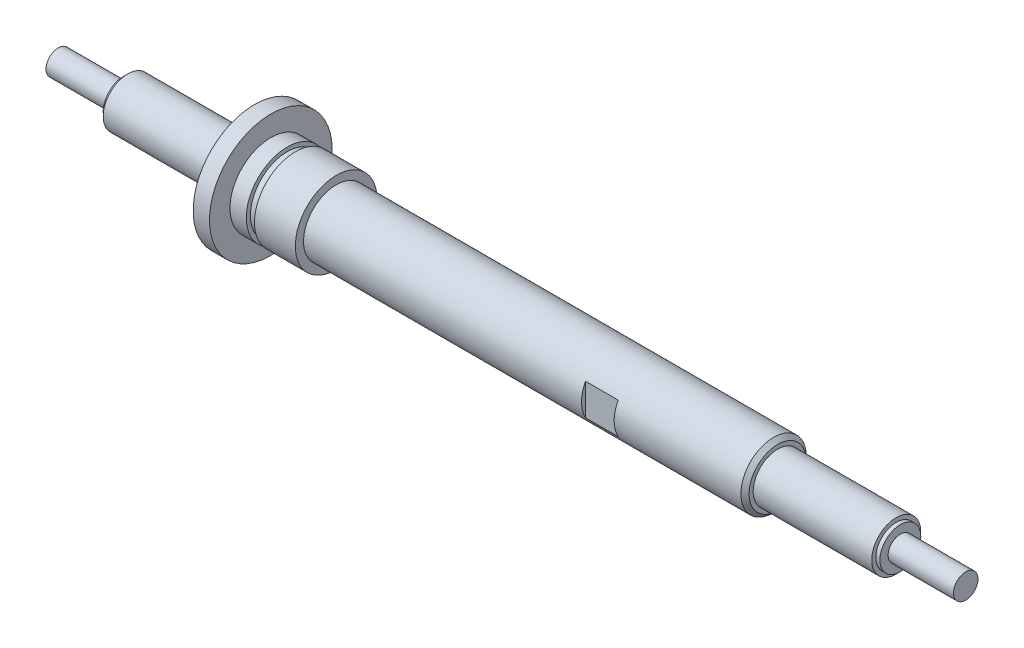
from build123d import *

# Parameters (mm, degrees)
SKETCH_1_R          = 4
EXTRUDE_1_DEPTH     = 1
SKETCH_2_R          = 3
EXTRUDE_2_DEPTH     = 6
SKETCH_3_R          = 3
EXTRUDE_3_DEPTH     = 17
SKETCH_4_R          = 7.5
EXTRUDE_4_DEPTH     = 2
SKETCH_5_R          = 5
EXTRUDE_5_DEPTH     = 8
SKETCH_6_R          = 4
EXTRUDE_6_DEPTH     = 54
EXTRUDE_START       = 6
SKETCH_7_R          = 3
EXTRUDE_7_DEPTH     = 6
EXTRUDE_START_2     = 17
SKETCH_8_R          = 3
EXTRUDE_8_DEPTH     = 17
CHAMFER_1_SIZE      = 0.5
CHAMFER_2_SIZE      = 0.5
CUT_EXTRUDE_START   = 2
SKETCH_11_R         = 5
SKETCH_11_R_2       = 4.5
CUT_EXTRUDE_2_DEPTH = 1
SKETCH_12_W         = 4
SKETCH_12_H         = 0.5
CUT_EXTRUDE_3_DEPTH = 5
SKETCH_14_R         = 3
SKETCH_14_R_2       = 1.5
CUT_EXTRUDE_5_DEPTH = 8
SKETCH_15_R         = 3
SKETCH_15_R_2       = 2.5
CUT_EXTRUDE_6_DEPTH = 0.5


with BuildPart() as part:
    # 草图1 → 凸台-拉伸1 (new body)
    with BuildSketch(Plane(origin=(0, 0, 0), x_dir=(0, 0, -1), z_dir=(1, 0, 0))):
        Circle(SKETCH_1_R)
    extrude(amount=EXTRUDE_1_DEPTH)

    # 草图2 → 凸台-拉伸2 (add)
    with BuildSketch(Plane.ZY):
        with Locations(Location((0, 0, 0), (0, 0, 180))):
            Circle(SKETCH_2_R)
    extrude(amount=EXTRUDE_2_DEPTH)

    # 草图3 → 凸台-拉伸3 (add)
    with BuildSketch(Plane.ZY.offset(6)):
        with Locations(Location((0, 0, 0), (0, 0, 180))):
            Circle(SKETCH_3_R)
    extrude(amount=EXTRUDE_3_DEPTH)

    # 草图4 → 凸台-拉伸4 (add)
    with BuildSketch(Plane(origin=(1, 0, 0), x_dir=(0, 0, -1), z_dir=(1, 0, 0))):
        Circle(SKETCH_4_R)
    extrude(amount=EXTRUDE_4_DEPTH)

    # 草图5 → 凸台-拉伸5 (add)
    with BuildSketch(Plane(origin=(3, 0, 0), x_dir=(0, 0, -1), z_dir=(1, 0, 0))):
        Circle(SKETCH_5_R)
    extrude(amount=EXTRUDE_5_DEPTH)

    # 草图6 → 凸台-拉伸6 (add)
    with BuildSketch(Plane(origin=(11, 0, 0), x_dir=(0, 0, -1), z_dir=(1, 0, 0))):
        Circle(SKETCH_6_R)
    extrude(amount=EXTRUDE_6_DEPTH)

    # 草图7 → 凸台-拉伸7 (add)
    with BuildSketch(Plane(origin=(65, 0, 0), x_dir=(0, 0, -1), z_dir=(1, 0, 0)).offset(EXTRUDE_START)):
        Circle(SKETCH_7_R)
    extrude(amount=-EXTRUDE_7_DEPTH)

    # 草图8 → 凸台-拉伸8 (add)
    with BuildSketch(Plane(origin=(71, 0, 0), x_dir=(0, 0, -1), z_dir=(1, 0, 0)).offset(EXTRUDE_START_2)):
        Circle(SKETCH_8_R)
    extrude(amount=-EXTRUDE_8_DEPTH)

    # 倒角1
    chamfer_1_edges = [part.edges().sort_by_distance(p)[0] for p in [
        (65, 0, 4),
    ]]
    chamfer(chamfer_1_edges, length=CHAMFER_1_SIZE)

    # 倒角2
    chamfer_2_edges = [part.edges().sort_by_distance(p)[0] for p in [
        (0, 0, 4),
    ]]
    chamfer(chamfer_2_edges, length=CHAMFER_2_SIZE)

    # 草图11 → 切除-拉伸2 (cut)
    with BuildSketch(Plane(origin=(3, 0, 0), x_dir=(0, 0, -1), z_dir=(1, 0, 0)).offset(CUT_EXTRUDE_START)):
        Circle(SKETCH_11_R)
        Circle(SKETCH_11_R_2, mode=Mode.SUBTRACT)
    extrude(amount=CUT_EXTRUDE_2_DEPTH, mode=Mode.SUBTRACT)

    # 草图12 → 切除-拉伸3 (cut, symmetric)
    with BuildSketch(Plane(origin=(0, 0, 0), x_dir=(1, 0, 0), z_dir=(0, 1, 0))):
        with Locations((47, 3.75)):
            Rectangle(SKETCH_12_W, SKETCH_12_H)
        with Locations((47, -3.75)):
            Rectangle(SKETCH_12_W, SKETCH_12_H)
    extrude(amount=CUT_EXTRUDE_3_DEPTH, both=True, mode=Mode.SUBTRACT)

    # 草图14 → 切除-拉伸5 (cut)
    with BuildSketch(Plane(origin=(88, 0, 0), x_dir=(0, 0, -1), z_dir=(1, 0, 0))):
        Circle(SKETCH_14_R)
        Circle(SKETCH_14_R_2, mode=Mode.SUBTRACT)
    cut_extrude_5 = extrude(amount=-CUT_EXTRUDE_5_DEPTH, mode=Mode.SUBTRACT)

    # 草图15 → 切除-拉伸6 (cut)
    with BuildSketch(Plane(origin=(80, 0, 0), x_dir=(0, 0, -1), z_dir=(1, 0, 0))):
        Circle(SKETCH_15_R)
        Circle(SKETCH_15_R_2, mode=Mode.SUBTRACT)
    cut_extrude_6 = extrude(amount=-CUT_EXTRUDE_6_DEPTH, mode=Mode.SUBTRACT)

    # 镜向2: 切除-拉伸5, 切除-拉伸6 across plane
    add(cut_extrude_5.mirror(Plane(origin=(32.5, 0, 0), x_dir=(0, 0, 1), z_dir=(1, 0, 0))), mode=Mode.SUBTRACT)
    add(cut_extrude_6.mirror(Plane(origin=(32.5, 0, 0), x_dir=(0, 0, 1), z_dir=(1, 0, 0))), mode=Mode.SUBTRACT)


solid = part.part
